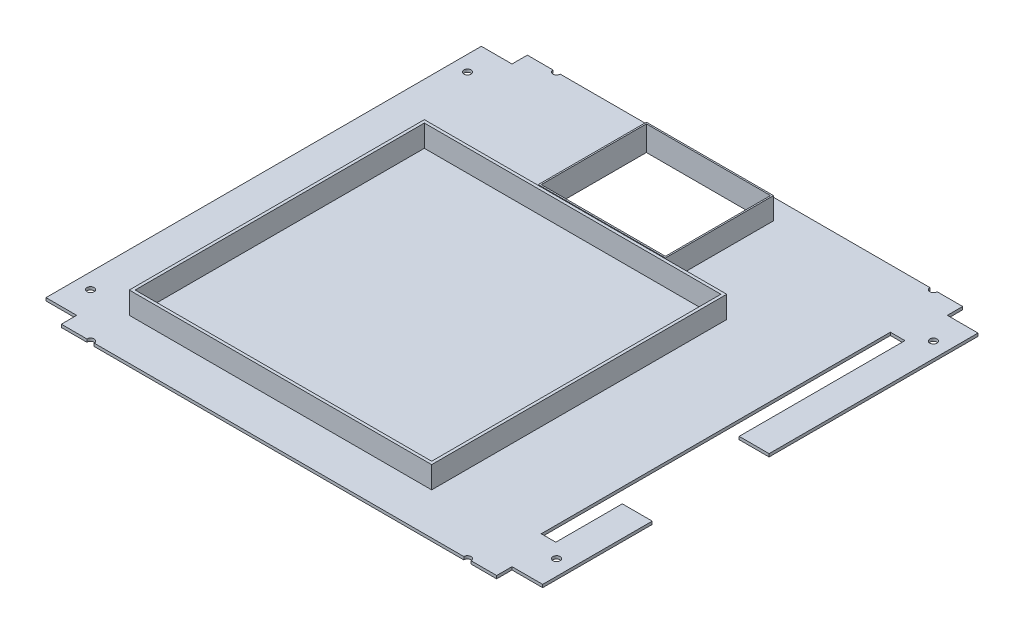
from build123d import *

# Parameters (mm, degrees)
EXTRUDE_1_DEPTH        = 2
SKETCH_4_W             = 10
SKETCH_4_H             = 239
CUT_EXTRUDE_1640_DEPTH = 481.836770641
SKETCH_841_R           = 2.5
CUT_EXTRUDE_2_DEPTH    = 481.836770641
SKETCH_5_W             = 207
SKETCH_5_H             = 202
SKETCH_5_W_2           = 203
SKETCH_5_H_2           = 198
EXTRUDE_1_2_DEPTH      = 15
SKETCH_7_W             = 85
SKETCH_7_H             = 72
CUT_EXTRUDE_4_DEPTH    = 482.066523466
SKETCH_9_W             = 20.5
SKETCH_9_H             = 80
SKETCH_9_W_2           = 298
SKETCH_9_H_2           = 10.5
CUT_EXTRUDE_5_DEPTH    = 10
SKETCH_10_W            = 87
SKETCH_10_H            = 74
SKETCH_10_W_2          = 85
SKETCH_10_H_2          = 72
EXTRUDE_2_DEPTH        = 15


with BuildPart() as part:
    # 草图2 → Extrude 1 (new body)
    with BuildSketch(Plane(origin=(0, 0, 0), x_dir=(1, 0, 0), z_dir=(0, 1, 0))):
        Polygon((21, 21), (21, 0), (319, 0), (319, 21), (340, 21), (340, 319), (319, 319), (319, 340), (21, 340), (21, 319), (0, 319), (0, 21), align=None)
    extrude(amount=EXTRUDE_1_DEPTH)

    # 草图4 → Cut-Extrude 1640 (cut, through all)
    with BuildSketch(Plane(origin=(0, 2, 0), x_dir=(1, 0, 0), z_dir=(0, 1, 0))):
        with Locations((314.5, 170)):
            Rectangle(SKETCH_4_W, SKETCH_4_H)
    extrude(amount=-CUT_EXTRUDE_1640_DEPTH, mode=Mode.SUBTRACT)

    # Sketch 841 → 切除-拉伸2 (cut, through all)
    with BuildSketch(Plane(origin=(0, 2, 0), x_dir=(1, 0, 0), z_dir=(0, 1, 0))):
        with Locations(Location((10.5, 41, 0), (0, 0, 270))):
            Circle(SKETCH_841_R)
        with Locations(Location((10.5, 299, 0), (0, 0, 90))):
            Circle(SKETCH_841_R)
        with Locations(Location((329.5, 299, 0), (0, 0, 270))):
            Circle(SKETCH_841_R)
        with Locations(Location((329.5, 41, 0), (0, 0, 90))):
            Circle(SKETCH_841_R)
        with Locations(Location((41, 10.5, 0), (0, 0, 270))):
            Circle(SKETCH_841_R)
        with Locations(Location((299, 10.5, 0), (0, 0, 90))):
            Circle(SKETCH_841_R)
        with Locations(Location((299, 329.5, 0), (0, 0, 270))):
            Circle(SKETCH_841_R)
        with Locations(Location((41, 329.5, 0), (0, 0, 90))):
            Circle(SKETCH_841_R)
    extrude(amount=-CUT_EXTRUDE_2_DEPTH, mode=Mode.SUBTRACT)

    # 草图5 → Extrude 1 2 (add)
    with BuildSketch(Plane(origin=(0, 2, 0), x_dir=(1, 0, 0), z_dir=(0, 1, 0))):
        with Locations((142.5, 140)):
            Rectangle(SKETCH_5_W, SKETCH_5_H)
        with Locations((142.5, 140)):
            Rectangle(SKETCH_5_W_2, SKETCH_5_H_2, mode=Mode.SUBTRACT)
    extrude(amount=EXTRUDE_1_2_DEPTH)

    # 草图7 → 切除-拉伸4 (cut, through all)
    with BuildSketch(Plane(origin=(0, 2, 0), x_dir=(1, 0, 0), z_dir=(0, 1, 0))):
        with Locations((160, 278.5)):
            Rectangle(SKETCH_7_W, SKETCH_7_H)
    extrude(amount=-CUT_EXTRUDE_4_DEPTH, mode=Mode.SUBTRACT)

    # 草图9 → 切除-拉伸5 (cut)
    with BuildSketch(Plane(origin=(0, 2, 0), x_dir=(1, 0, 0), z_dir=(0, 1, 0))):
        with Locations((329.75, 136)):
            Rectangle(SKETCH_9_W, SKETCH_9_H)
        with Locations((170, 5.25)):
            Rectangle(SKETCH_9_W_2, SKETCH_9_H_2)
        with Locations((170, 334.75)):
            Rectangle(SKETCH_9_W_2, SKETCH_9_H_2)
    extrude(amount=-CUT_EXTRUDE_5_DEPTH, mode=Mode.SUBTRACT)

    # 草图10 → 拉伸-薄壁2 (add)
    with BuildSketch(Plane(origin=(0, 2, 0), x_dir=(1, 0, 0), z_dir=(0, 1, 0))):
        with Locations((160, 278.5)):
            Rectangle(SKETCH_10_W, SKETCH_10_H)
        with Locations((160, 278.5)):
            Rectangle(SKETCH_10_W_2, SKETCH_10_H_2, mode=Mode.SUBTRACT)
    extrude(amount=EXTRUDE_2_DEPTH)


solid = part.part
